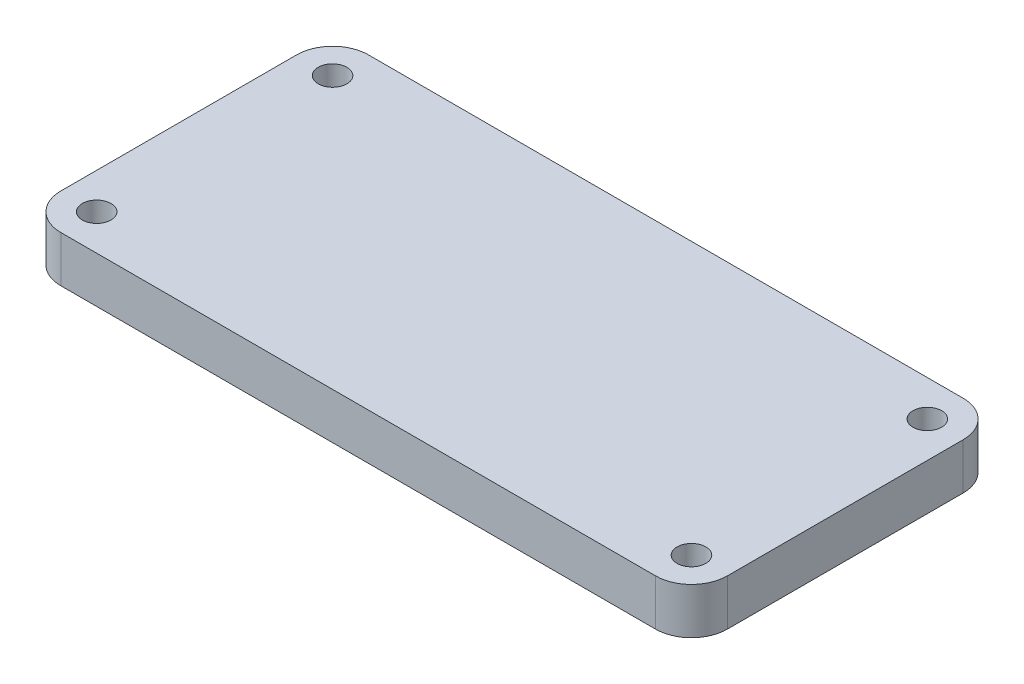
from build123d import *

# Parameters (mm, degrees)
SKETCH_1_R      = 1.4
EXTRUDE_1_DEPTH = 4.5


with BuildPart() as part:
    # 草图1 → 凸台-拉伸1 (new body)
    with BuildSketch(Plane(origin=(0, 0, 0), x_dir=(1, 0, 0), z_dir=(0, 1, 0))):
        with BuildLine():
            Line((-29, -15), (29, -15))
            ThreePointArc((29, -15), (31.474873734, -13.974873734), (32.5, -11.5))
            Line((32.5, -11.5), (32.5, 11.5))
            ThreePointArc((32.5, 11.5), (31.474873734, 13.974873734), (29, 15))
            Line((29, 15), (-29, 15))
            ThreePointArc((-29, 15), (-31.474873734, 13.974873734), (-32.5, 11.5))
            Line((-32.5, 11.5), (-32.5, -11.5))
            ThreePointArc((-32.5, -11.5), (-31.474873734, -13.974873734), (-29, -15))
        make_face()
        with Locations(Location((-29, -11.5, 0), (0, 0, 270))):
            Circle(SKETCH_1_R, mode=Mode.SUBTRACT)
        with Locations(Location((-29, 11.5, 0), (0, 0, 270))):
            Circle(SKETCH_1_R, mode=Mode.SUBTRACT)
        with Locations(Location((29, 11.5, 0), (0, 0, 270))):
            Circle(SKETCH_1_R, mode=Mode.SUBTRACT)
        with Locations(Location((29, -11.5, 0), (0, 0, 270))):
            Circle(SKETCH_1_R, mode=Mode.SUBTRACT)
    extrude(amount=EXTRUDE_1_DEPTH)


solid = part.part
